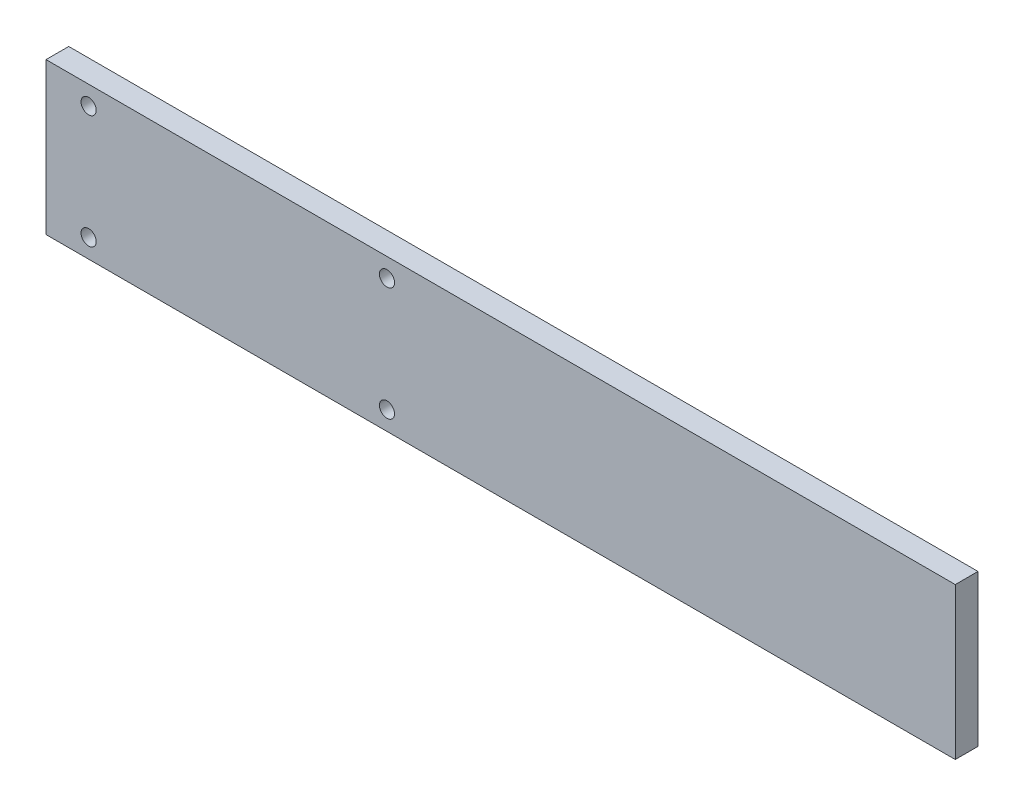
from build123d import *

# Parameters (mm, degrees)
SKETCH1_W           = 3048
SKETCH1_H           = 508
BOSS_EXTRUDE1_DEPTH = 76.2
SKETCH2_R           = 25.4
CUT_EXTRUDE1_DEPTH  = 1547.899621824


with BuildPart() as part:
    # Sketch1 → Boss-Extrude1 (new body)
    with BuildSketch(Plane.XY):
        Rectangle(SKETCH1_W, SKETCH1_H)
    extrude(amount=BOSS_EXTRUDE1_DEPTH)

    # Sketch2 → Cut-Extrude1 (cut, through all)
    with BuildSketch(Plane.XY.offset(76.2)):
        with Locations((-381, -190.5)):
            Circle(SKETCH2_R)
        with Locations((-1381.125, -190.5)):
            Circle(SKETCH2_R)
        with Locations((-381, 190.5)):
            Circle(SKETCH2_R)
        with Locations((-1381.125, 190.5)):
            Circle(SKETCH2_R)
    extrude(amount=-CUT_EXTRUDE1_DEPTH, mode=Mode.SUBTRACT)


solid = part.part
